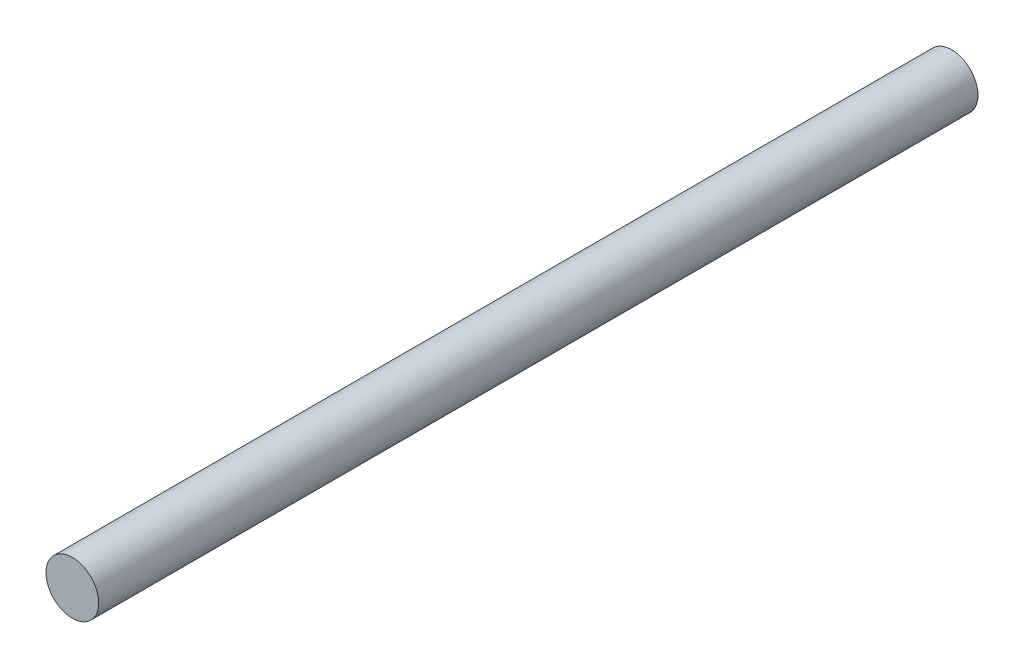
from build123d import *

# Parameters (mm, degrees)
SKETCH1_R           = 7.5
BOSS_EXTRUDE1_DEPTH = 250


with BuildPart() as part:
    # Sketch1 → Boss-Extrude1 (new body)
    with BuildSketch(Plane.XY):
        Circle(SKETCH1_R)
    extrude(amount=BOSS_EXTRUDE1_DEPTH)


solid = part.part
